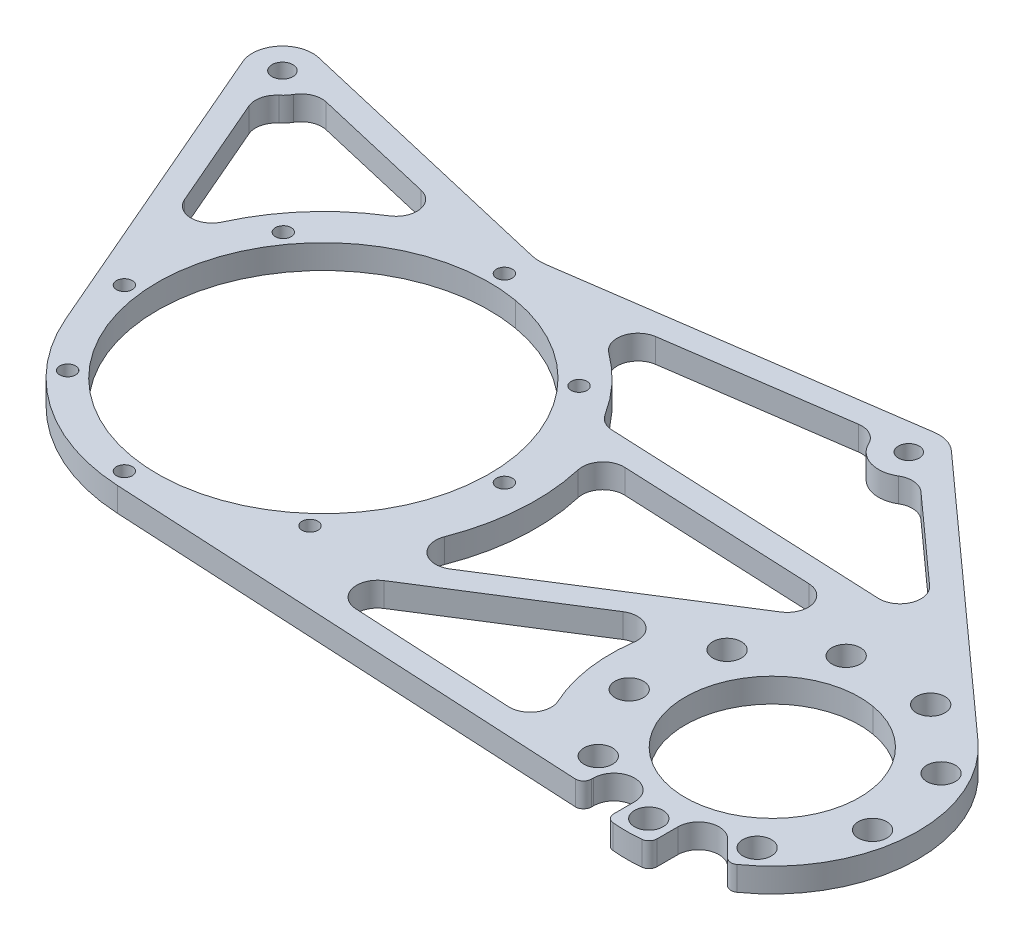
from build123d import *

# Parameters (mm, degrees)
SKETCH2_R           = 4.5
SKETCH2_R_2         = 27.4955
SKETCH2_R_3         = 2.5
SKETCH2_R_4         = 52.3875
SKETCH2_R_5         = 3.3
BOSS_EXTRUDE1_DEPTH = 7.62
CUT_EXTRUDE1_DEPTH  = 977.654400972
FILLET2_R           = 12.7
CUT_EXTRUDE2_DEPTH  = 977.654400972
FILLET3_R           = 6.604


with BuildPart() as part:
    # Sketch2 → Boss-Extrude1 (new body)
    with BuildSketch(Plane(origin=(0, 31.381947118, 0), x_dir=(1, 0, 0), z_dir=(0, 1, 0))):
        with BuildLine():
            ThreePointArc((-706.758334948, -176.701988839), (-700.258334948, -170.201988839), (-693.758334948, -176.701988839))
            Line((-693.758334948, -176.701988839), (-693.758334948, -183.274721629))
            ThreePointArc((-693.758334948, -183.274721629), (-693.101169654, -184.979577479), (-691.469725918, -185.802250576))
            ThreePointArc((-691.469725918, -185.802250576), (-686.919549358, -186.027976628), (-682.369372798, -185.802250576))
            ThreePointArc((-682.369372798, -185.802250576), (-680.737929062, -184.979577479), (-680.080763768, -183.274721629))
            Line((-680.080763768, -183.274721629), (-680.080763768, -176.701988839))
            ThreePointArc((-680.080763768, -176.701988839), (-676.068206079, -170.696771877), (-668.984569691, -172.105794761))
            Line((-668.984569691, -172.105794761), (-663.719686073, -177.370678379))
            ThreePointArc((-663.719686073, -177.370678379), (-662.142049476, -178.105218992), (-660.461885462, -177.651858179))
            ThreePointArc((-660.461885462, -177.651858179), (-641.02731599, -142.794705094), (-656.175138478, -105.872258186))
            Line((-656.175138478, -105.872258186), (-739.714556945, -30.733548866))
            ThreePointArc((-739.714556945, -30.733548866), (-742.67316861, -28.92213442), (-746.084255332, -28.29039661))
            Line((-746.084255332, -28.29039661), (-949.218629158, -22.875315026))
            ThreePointArc((-949.218629158, -22.875315026), (-957.176615495, -27.166188695), (-957.964688125, -36.172857609))
            Line((-957.964688125, -36.172857609), (-915.540423748, -134.526980787))
            ThreePointArc((-915.540423748, -134.526980787), (-894.053054389, -160.825584136), (-861.92593364, -171.83338557))
            Line((-861.92593364, -171.83338557), (-709.298334948, -179.818999281))
            ThreePointArc((-709.298334948, -179.818999281), (-707.502283723, -179.075050505), (-706.758334948, -177.278999281))
            Line((-706.758334948, -177.278999281), (-706.758334948, -176.701988839))
        make_face()
        with Locations((-686.919549358, -179.053976628)):
            Circle(SKETCH2_R, mode=Mode.SUBTRACT)
        with Locations((-711.988266136, -169.92970991)):
            Circle(SKETCH2_R, mode=Mode.SUBTRACT)
        with Locations((-661.85083258, -169.92970991)):
            Circle(SKETCH2_R, mode=Mode.SUBTRACT)
        with Locations((-725.327051725, -146.826255557)):
            Circle(SKETCH2_R, mode=Mode.SUBTRACT)
        with Locations((-686.919549358, -140.053976628)):
            Circle(SKETCH2_R_2, mode=Mode.SUBTRACT)
        with Locations((-648.51204699, -146.826255557)):
            Circle(SKETCH2_R, mode=Mode.SUBTRACT)
        with Locations((-720.694540106, -120.553976628)):
            Circle(SKETCH2_R, mode=Mode.SUBTRACT)
        with Locations((-653.14455861, -120.553976628)):
            Circle(SKETCH2_R, mode=Mode.SUBTRACT)
        with Locations((-700.258334948, -103.405964417)):
            Circle(SKETCH2_R, mode=Mode.SUBTRACT)
        with Locations((-673.580763768, -103.405964417)):
            Circle(SKETCH2_R, mode=Mode.SUBTRACT)
        with Locations((-816.220313684, -71.764639846)):
            Circle(SKETCH2_R_3, mode=Mode.SUBTRACT)
        with Locations((-858.69104046, -52.855453999)):
            Circle(SKETCH2_R_3, mode=Mode.SUBTRACT)
        with Locations((-901.161767236, -148.246268152)):
            Circle(SKETCH2_R_3, mode=Mode.SUBTRACT)
        with Locations((-864.664842136, -166.842380319)):
            Circle(SKETCH2_R_3, mode=Mode.SUBTRACT)
        with Locations((-820.450226307, -152.476180775)):
            Circle(SKETCH2_R_3, mode=Mode.SUBTRACT)
        with Locations((-915.52796678, -115.979255675)):
            Circle(SKETCH2_R_3, mode=Mode.SUBTRACT)
        with Locations((-858.69104046, -110.005453999)):
            Circle(SKETCH2_R_4, mode=Mode.SUBTRACT)
        with Locations((-801.54104046, -110.005453999)):
            Circle(SKETCH2_R_3, mode=Mode.SUBTRACT)
        with Locations((-904.926361688, -76.41352683)):
            Circle(SKETCH2_R_3, mode=Mode.SUBTRACT)
        with Locations((-949.218629158, -32.400315026)):
            Circle(SKETCH2_R_5, mode=Mode.SUBTRACT)
        with Locations((-746.084255332, -37.81539661)):
            Circle(SKETCH2_R_5, mode=Mode.SUBTRACT)
    extrude(amount=BOSS_EXTRUDE1_DEPTH)

    # Sketch3 → Cut-Extrude1 (cut, through all)
    with BuildSketch(Plane.XZ.offset(-31.381947118)):
        with BuildLine():
            ThreePointArc((-746.084255332, 28.29039661), (-746.764244179, 28.314699785), (-747.440763024, 28.387485289))
            Line((-747.440763024, 28.387485289), (-856.972172798, 44.147094697))
            Line((-856.972172798, 44.147094697), (-947.053929007, 23.124556391))
            ThreePointArc((-947.053929007, 23.124556391), (-947.877357404, 22.970224089), (-948.71116187, 22.888842903))
            Line((-948.71116187, 22.888842903), (-746.084255332, 28.29039661))
        make_face()
    extrude(amount=-CUT_EXTRUDE1_DEPTH, mode=Mode.SUBTRACT)

    # Fillet2
    fillet2_edges = [part.edges().sort_by_distance(p)[0] for p in [
        (-856.972172798, 35.191947118, 44.147094697),
    ]]
    fillet(fillet2_edges, radius=FILLET2_R)

    # Sketch4 → Cut-Extrude2 (cut, through all)
    with BuildSketch(Plane.XZ.offset(-31.381947118)):
        with BuildLine():
            ThreePointArc((-755.592985701, 37.258915017), (-748.851749471, 46.929484671), (-737.871550291, 42.640031406))
            Line((-737.871550291, 42.640031406), (-692.514052151, 83.436387555))
            Line((-692.514052151, 83.436387555), (-802.478652725, 78.47305445))
            ThreePointArc((-802.478652725, 78.47305445), (-817.379263712, 60.533625064), (-837.688346094, 49.070967987))
            Line((-837.688346094, 49.070967987), (-755.592985701, 37.258915017))
        make_face()
        with BuildLine():
            Line((-922.300574954, 99.615464698), (-947.271519207, 41.724176235))
            ThreePointArc((-947.271519207, 41.724176235), (-941.911570095, 38.510348812), (-939.697338874, 32.666127625))
            Line((-939.697338874, 32.666127625), (-875.229784474, 47.711034484))
            ThreePointArc((-875.229784474, 47.711034484), (-906.434669416, 66.707986979), (-922.300574954, 99.615464698))
        make_face()
        with BuildLine():
            ThreePointArc((-732.476443701, 117.008797222), (-737.745943415, 144.869429162), (-727.337961012, 171.244727106))
            Line((-727.337961012, 171.244727106), (-811.290400037, 166.852259728))
            Line((-811.290400037, 166.852259728), (-732.476443701, 117.008797222))
        make_face()
        with BuildLine():
            Line((-704.829350056, 90.508285443), (-812.734441613, 158.749541627))
            ThreePointArc((-812.734441613, 158.749541627), (-793.421898525, 125.102942774), (-795.997635489, 86.393337843))
            Line((-795.997635489, 86.393337843), (-704.829350056, 90.508285443))
        make_face()
    extrude(amount=-CUT_EXTRUDE2_DEPTH, mode=Mode.SUBTRACT)

    # Fillet3
    fillet3_edges = [part.edges().sort_by_distance(p)[0] for p in [
        (-732.476443701, 35.191947118, 117.008797222),
        (-727.337961012, 35.191947118, 171.244727106),
        (-811.290400037, 35.191947118, 166.852259728),
        (-704.829350056, 35.191947118, 90.508285443),
        (-795.997635489, 35.191947118, 86.393337843),
        (-812.734441613, 35.191947118, 158.749541627),
        (-692.514052151, 35.191947118, 83.436387555),
        (-802.478652725, 35.191947118, 78.47305445),
        (-837.688346094, 35.191947118, 49.070967987),
        (-875.229784474, 35.191947118, 47.711034484),
        (-922.300574954, 35.191947118, 99.615464698),
        (-737.871550291, 35.191947118, 42.640031406),
        (-755.592985701, 35.191947118, 37.258915017),
        (-939.697338874, 35.191947118, 32.666127625),
        (-947.271519207, 35.191947118, 41.724176235),
    ]]
    fillet(fillet3_edges, radius=FILLET3_R)


solid = part.part
